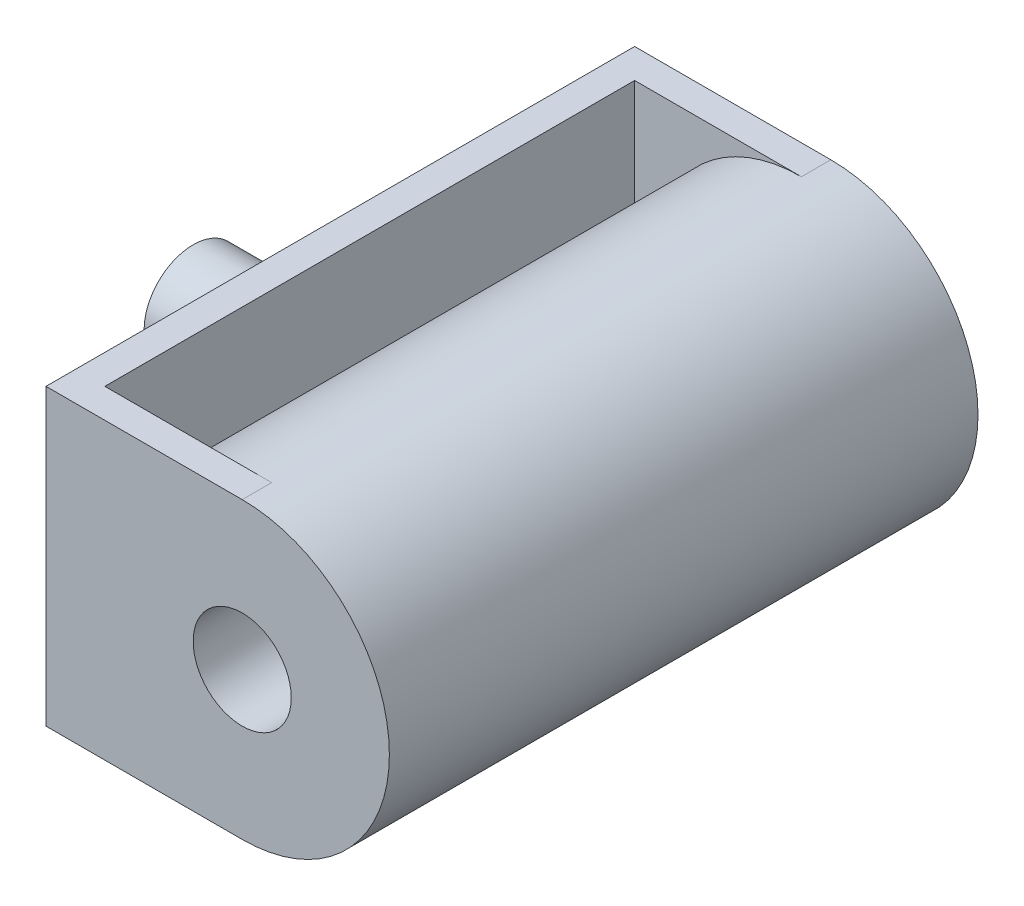
from build123d import *

# Parameters (mm, degrees)
SKETCH1_R           = 15
BOSS_EXTRUDE1_DEPTH = 60
BOSS_EXTRUDE2_DEPTH = 15
SKETCH3_R           = 5
BOSS_EXTRUDE3_DEPTH = 15
SKETCH4_R           = 5
CUT_EXTRUDE1_DEPTH  = 146


with BuildPart() as part:
    # Sketch1 → Boss-Extrude1 (new body)
    with BuildSketch(Plane.XY):
        Circle(SKETCH1_R)
    extrude(amount=BOSS_EXTRUDE1_DEPTH)

    # Sketch2 → Boss-Extrude2 (add, symmetric)
    with BuildSketch(Plane(origin=(0, 0, 0), x_dir=(1, 0, 0), z_dir=(0, 1, 0))):
        Polygon((0, 0), (-20, 0), (-20, -30), (-17, -30), (-17, -3), (0, -3), align=None)
    boss_extrude2 = extrude(amount=BOSS_EXTRUDE2_DEPTH, both=True)

    # Mirror1: Boss-Extrude2 across plane
    add(boss_extrude2.mirror(Plane(origin=(-17, -15, 30), x_dir=(1, 0, 0), z_dir=(0, 0, 1))))

    # Sketch3 → Boss-Extrude3 (add)
    with BuildSketch(Plane.ZY.offset(20)):
        with Locations((30, 0)):
            Circle(SKETCH3_R)
    extrude(amount=BOSS_EXTRUDE3_DEPTH)

    # Sketch4 → Cut-Extrude1 (cut)
    with BuildSketch(Plane.XY.offset(60)):
        Circle(SKETCH4_R)
    extrude(amount=-CUT_EXTRUDE1_DEPTH, mode=Mode.SUBTRACT)


solid = part.part
